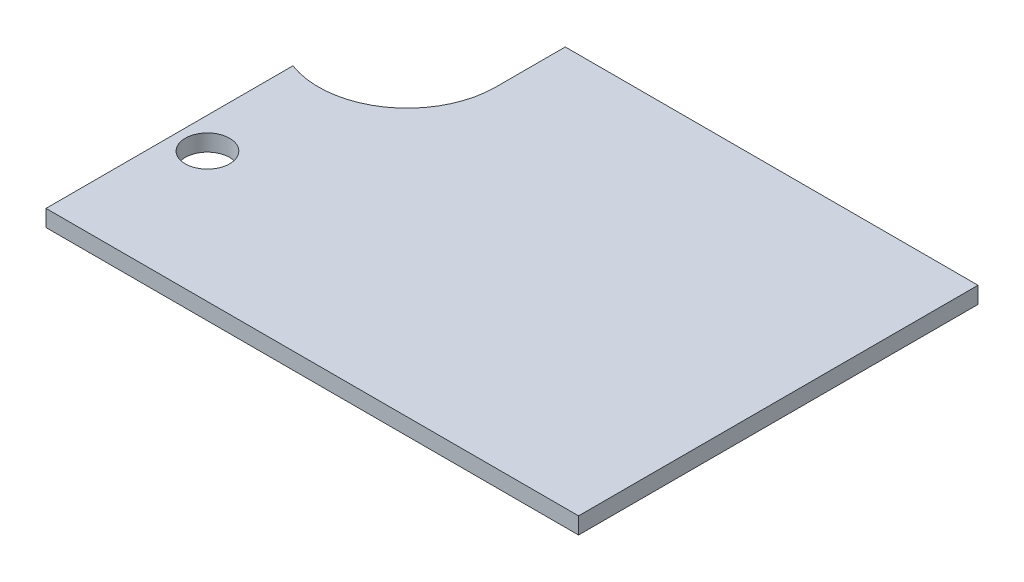
from build123d import *

# Parameters (mm, degrees)
SKETCH1_W           = 609.6
SKETCH1_H           = 457.2
BOSS_EXTRUDE1_DEPTH = 19.05
SKETCH2_R           = 25.4
CUT_EXTRUDE1_DEPTH  = 382.475952715
SKETCH4_R           = 101.6
CUT_EXTRUDE2_DEPTH  = 382.475952715
SKETCH6_W           = 137.16
SKETCH6_H           = 79.375
CUT_EXTRUDE3_DEPTH  = 382.475952715


with BuildPart() as part:
    # Sketch1 → Boss-Extrude1 (new body)
    with BuildSketch(Plane(origin=(0, 0, 0), x_dir=(1, 0, 0), z_dir=(0, 1, 0))):
        Rectangle(SKETCH1_W, SKETCH1_H)
    extrude(amount=BOSS_EXTRUDE1_DEPTH)

    # Sketch2 → Cut-Extrude1 (cut, through all)
    with BuildSketch(Plane.XZ):
        with Locations(Location((-269.24, 79.375, 0), (0, 0, 270))):
            Circle(SKETCH2_R)
    extrude(amount=-CUT_EXTRUDE1_DEPTH, mode=Mode.SUBTRACT)

    # Sketch4 → Cut-Extrude2 (cut, through all)
    with BuildSketch(Plane.XZ):
        with Locations((-269.24, -149.225)):
            Circle(SKETCH4_R)
    extrude(amount=-CUT_EXTRUDE2_DEPTH, mode=Mode.SUBTRACT)

    # Sketch6 → Cut-Extrude3 (cut, through all)
    with BuildSketch(Plane(origin=(0, 19.05, 0), x_dir=(1, 0, 0), z_dir=(0, 1, 0))):
        with Locations((-236.22, 188.9125)):
            Rectangle(SKETCH6_W, SKETCH6_H)
    extrude(amount=-CUT_EXTRUDE3_DEPTH, mode=Mode.SUBTRACT)


solid = part.part
